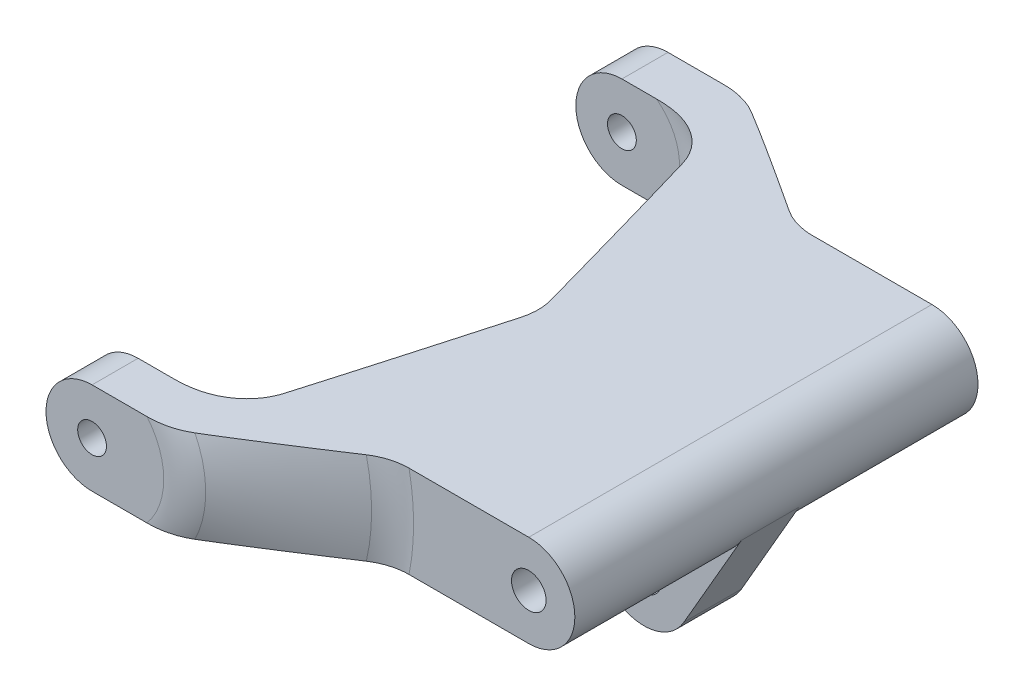
from build123d import *

# Parameters (mm, degrees)
ESQUISSE1_R        = 1.25
ESQUISSE1_R_2      = 1.5
BOSS_EXTRU_1_DEPTH = 25
ESQUISSE3_R        = 1.5
BOSS_EXTRU_2_DEPTH = 2.5


with BuildPart() as part:
    # Esquisse1 → Boss.-Extru.1 (new, symmetric)
    with BuildSketch(Plane.XY):
        with BuildLine():
            Line((0, 4), (30.413812651, 4))
            ThreePointArc((30.413812651, 4), (34.413812651, 0), (30.413812651, -4))
            Line((30.413812651, -4), (0, -4))
            ThreePointArc((0, -4), (-4, 0), (0, 4))
        make_face()
        Circle(ESQUISSE1_R, mode=Mode.SUBTRACT)
        with Locations((30.413812651, 0)):
            Circle(ESQUISSE1_R_2, mode=Mode.SUBTRACT)
    extrude(amount=BOSS_EXTRU_1_DEPTH, both=True)

    # Esquisse3 → Boss.-Extru.2 (add, symmetric)
    with BuildSketch(Plane.XY):
        with BuildLine():
            Line((33.877914267, -2), (28.877914267, -10.660254038))
            ThreePointArc((28.877914267, -10.660254038), (25.149451096, -12.651508599), (21.716189443, -10.185895741))
            ThreePointArc((21.716189443, -10.185895741), (18.033559179, -5.689132338), (12.472131421, -4))
            Line((12.472131421, -4), (30.413812651, -4))
            ThreePointArc((30.413812651, -4), (32.413812651, -3.464101615), (33.877914267, -2))
        make_face()
        with Locations((25.413812651, -8.660254038)):
            Circle(ESQUISSE3_R, mode=Mode.SUBTRACT)
    extrude(amount=BOSS_EXTRU_2_DEPTH, both=True)

    # Esquisse4 → Enlèvement de matière-Révolution1 (revolve, cut)
    with BuildSketch(Plane(origin=(0, 0, 0), x_dir=(1, 0, 0), z_dir=(0, 1, 0))):
        with BuildLine():
            Line((0, 21), (5, 21))
            ThreePointArc((5, 21), (8.043807145, 19.966766701), (9.829629131, 17.294095226))
            Line((9.829629131, 17.294095226), (14.11681621, 1.294095226))
            ThreePointArc((14.11681621, 1.294095226), (14.287187079, 0), (14.11681621, -1.294095226))
            Line((14.11681621, -1.294095226), (9.829629131, -17.294095226))
            ThreePointArc((9.829629131, -17.294095226), (8.043807145, -19.966766701), (5, -21))
            Line((5, -21), (0, -21))
            Line((0, -21), (0, 21))
        make_face()
        with BuildLine():
            Line((34.413812651, 25), (6.221001618, 25))
            ThreePointArc((6.221001618, 25), (7.680759567, 24.782165485), (9.01332325, 24.147642692))
            Line((9.01332325, 24.147642692), (17.621491019, 18.352357308))
            ThreePointArc((17.621491019, 18.352357308), (18.954054703, 17.717834515), (20.413812651, 17.5))
            Line((20.413812651, 17.5), (34.413812651, 17.5))
            Line((34.413812651, 17.5), (34.413812651, 25))
        make_face()
        with BuildLine():
            Line((17.621491019, -18.352357308), (9.01332325, -24.147642692))
            ThreePointArc((9.01332325, -24.147642692), (7.680759567, -24.782165485), (6.221001618, -25))
            Line((6.221001618, -25), (34.413812651, -25))
            Line((34.413812651, -25), (34.413812651, -17.5))
            Line((34.413812651, -17.5), (20.413812651, -17.5))
            ThreePointArc((20.413812651, -17.5), (18.954054703, -17.717834515), (17.621491019, -18.352357308))
        make_face()
    revolve(axis=Axis((0, 0, -21), (0, 0, 1)), mode=Mode.SUBTRACT)


solid = part.part
